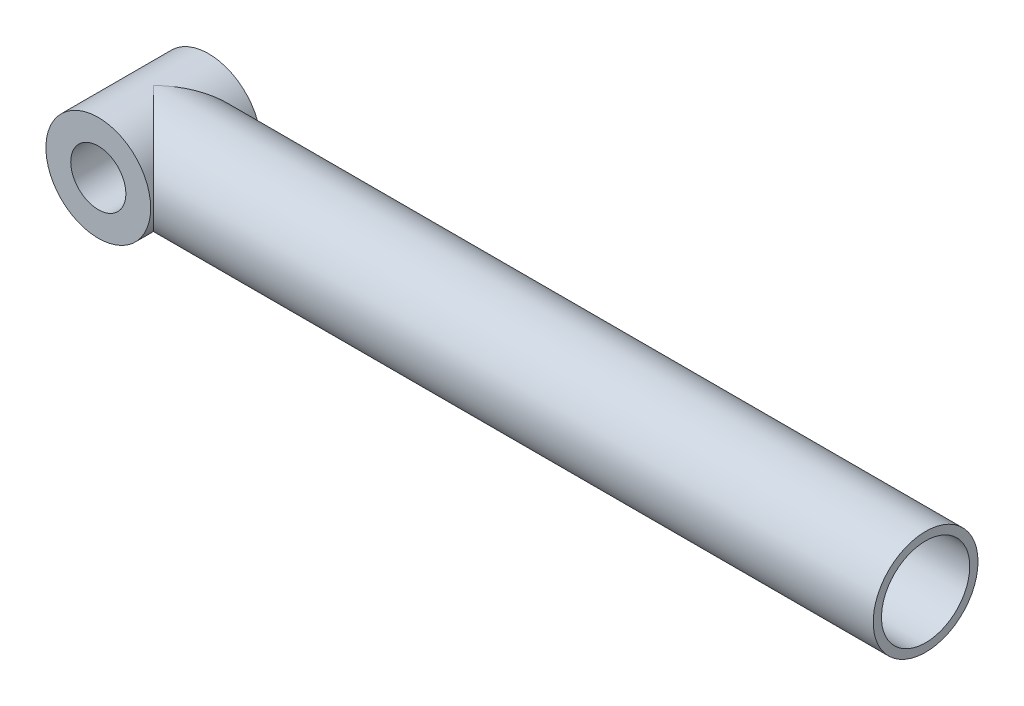
from build123d import *

# Parameters (mm, degrees)
SKETCH1_R                = 47.5
BOSS_EXTRUDE1_DEPTH      = 100
BOSS_EXTRUDE2_REACH      = 757.654
BOSS_EXTRUDE2_END_RADIUS = 47.5
SKETCH2_R                = 47.5
SKETCH2_R_2              = 40
BOSS_EXTRUDE4_REACH      = 661.36
SKETCH3_R                = 40
SKETCH4_R                = 25
CUT_EXTRUDE1_DEPTH       = 100


with BuildPart() as part:
    # Sketch1 → Boss-Extrude1 (new body)
    with BuildSketch(Plane.XY):
        Circle(SKETCH1_R)
    extrude(amount=BOSS_EXTRUDE1_DEPTH)

    # Boss-Extrude2: up to this cylinder (the profile starts outside it)
    boss_extrude2_end = Plane(origin=(0, 0, 96.156497), z_dir=(0, 0, -1)) * Cylinder(BOSS_EXTRUDE2_END_RADIUS, 1611.308, mode=Mode.PRIVATE)
    # Sketch2 → Boss-Extrude2 (add, up to the surface)
    with BuildSketch(Plane(origin=(700, 0, 0), x_dir=(0, 0, -1), z_dir=(1, 0, 0)), mode=Mode.PRIVATE) as boss_extrude2_sk1:
        with Locations((-50, 0)):
            Circle(SKETCH2_R)
        with Locations((-50, 0)):
            Circle(SKETCH2_R_2, mode=Mode.SUBTRACT)
    boss_extrude2_tool1 = extrude(boss_extrude2_sk1.sketch, amount=-BOSS_EXTRUDE2_REACH, mode=Mode.PRIVATE) - boss_extrude2_end
    add(boss_extrude2_tool1.solids().sort_by_distance((700, 0, 96.156497))[0])

    # Sketch3 → Boss-Extrude4 (add, up to next)
    with BuildSketch(Plane(origin=(50, 0, 0), x_dir=(0, 0, -1), z_dir=(1, 0, 0)), mode=Mode.PRIVATE) as boss_extrude4_sk1:
        with Locations((-50, 0)):
            Circle(SKETCH3_R)
    boss_extrude4_tool1 = extrude(boss_extrude4_sk1.sketch, amount=-BOSS_EXTRUDE4_REACH, mode=Mode.PRIVATE) - part.part
    add(boss_extrude4_tool1.solids().sort_by_distance((50, 0, 50))[0])

    # Sketch4 → Cut-Extrude1 (cut)
    with BuildSketch(Plane(origin=(0, 0, 0), x_dir=(-1, 0, 0), z_dir=(0, 0, -1))):
        Circle(SKETCH4_R)
    extrude(amount=-CUT_EXTRUDE1_DEPTH, mode=Mode.SUBTRACT)


solid = part.part
